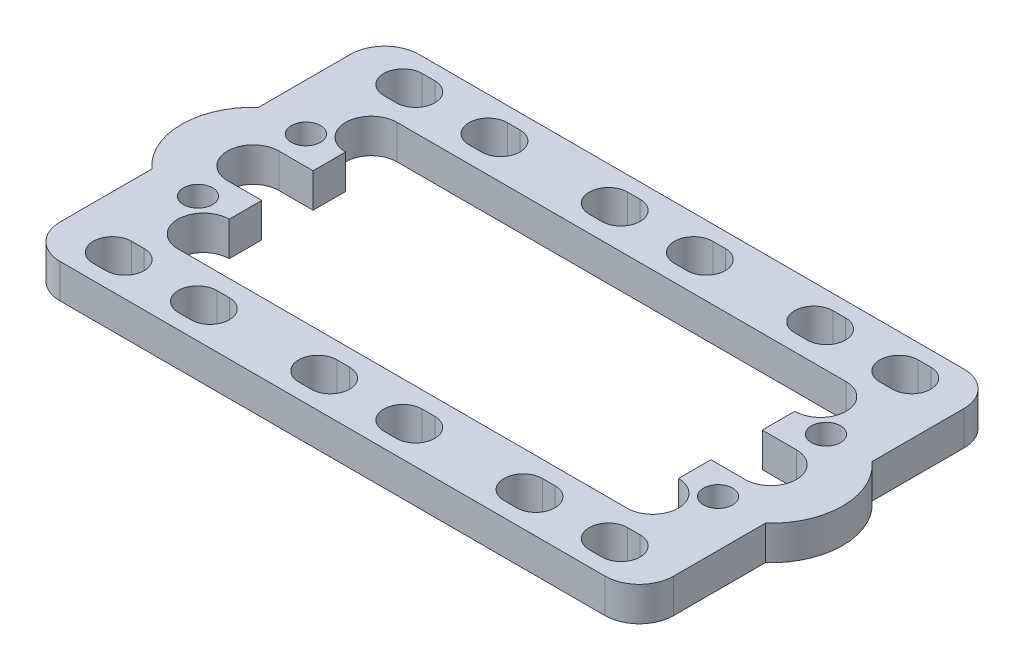
from build123d import *

# Parameters (mm, degrees)
BOSS_EXTRUDE1_DEPTH   = 3.175
F_6_32_TAPPED_HOLE1_D = 2.7051
CUT_EXTRUDE1_REACH    = 69.902


with BuildPart() as part:
    # Sketch1 → Boss-Extrude1 (new body)
    with BuildSketch(Plane(origin=(0, 0, 0), x_dir=(1, 0, 0), z_dir=(0, 1, 0))):
        with BuildLine():
            Line((3.175, 0), (53.721, 0))
            ThreePointArc((53.721, 0), (55.96606403, 0.92993597), (56.896, 3.175))
            Line((56.896, 3.175), (56.896, 11.684))
            ThreePointArc((56.896, 11.684), (59.1058, 16.637), (56.896, 21.59))
            Line((56.896, 21.59), (56.896, 30.099))
            ThreePointArc((56.896, 30.099), (55.96606403, 32.34406403), (53.721, 33.274))
            Line((53.721, 33.274), (3.175, 33.274))
            ThreePointArc((3.175, 33.274), (0.92993597, 32.34406403), (0, 30.099))
            Line((0, 30.099), (0, 21.59))
            ThreePointArc((0, 21.59), (-2.2098, 16.637), (0, 11.684))
            Line((0, 11.684), (0, 3.175))
            ThreePointArc((0, 3.175), (0.92993597, 0.92993597), (3.175, 0))
        make_face()
        with BuildLine():
            Line((49.276, 26.797), (7.62, 26.797))
            ThreePointArc((7.62, 26.797), (5.23875, 24.41575), (7.62, 22.0345))
            Line((7.62, 22.0345), (7.62, 19.01825))
            Line((7.62, 19.01825), (4.445875862, 19.01825))
            ThreePointArc((4.445875862, 19.01825), (2.064625862, 16.637), (4.445875862, 14.25575))
            Line((4.445875862, 14.25575), (7.62, 14.25575))
            Line((7.62, 14.25575), (7.62, 11.2395))
            ThreePointArc((7.62, 11.2395), (5.23875, 8.85825), (7.62, 6.477))
            Line((7.62, 6.477), (49.276, 6.477))
            ThreePointArc((49.276, 6.477), (51.65725, 8.85825), (49.276, 11.2395))
            Line((49.276, 11.2395), (49.276, 14.25575))
            Line((49.276, 14.25575), (52.450124138, 14.25575))
            ThreePointArc((52.450124138, 14.25575), (54.831374138, 16.637), (52.450124138, 19.01825))
            Line((52.450124138, 19.01825), (49.276, 19.01825))
            Line((49.276, 19.01825), (49.276, 22.0345))
            ThreePointArc((49.276, 22.0345), (51.65725, 24.41575), (49.276, 26.797))
        make_face(mode=Mode.SUBTRACT)
    extrude(amount=BOSS_EXTRUDE1_DEPTH)

    # #6-32 Tapped Hole1 (through all)
    with Locations(Plane(origin=(0, 3.175, 0), x_dir=(1, 0, 0), z_dir=(0, 1, 0))):
        with Locations((4.3307, 21.6408), (4.3307, 11.6332), (52.5653, 11.6332), (52.5653, 21.6408)):
            Hole(F_6_32_TAPPED_HOLE1_D / 2)

    # Sketch5 → Cut-Extrude1 (cut, up to next)
    with BuildSketch(Plane(origin=(0, 3.175, 0), x_dir=(1, 0, 0), z_dir=(0, 1, 0)), mode=Mode.PRIVATE) as cut_extrude1_sk1:
        with BuildLine():
            Line((23.9141, 31.8897), (25.0825, 31.8897))
            ThreePointArc((25.0825, 31.8897), (26.8605, 30.1117), (25.0825, 28.3337))
            Line((25.0825, 28.3337), (23.9141, 28.3337))
            ThreePointArc((23.9141, 28.3337), (22.1361, 30.1117), (23.9141, 31.8897))
        make_face()
    cut_extrude1_tool1 = extrude(cut_extrude1_sk1.sketch, amount=-CUT_EXTRUDE1_REACH, mode=Mode.PRIVATE) & part.part
    # Sketch5 → Cut-Extrude1 (cut, up to next)
    with BuildSketch(Plane(origin=(0, 3.175, 0), x_dir=(1, 0, 0), z_dir=(0, 1, 0)), mode=Mode.PRIVATE) as cut_extrude1_sk2:
        with BuildLine():
            Line((12.7635, 31.8897), (13.9319, 31.8897))
            ThreePointArc((13.9319, 31.8897), (15.7099, 30.1117), (13.9319, 28.3337))
            Line((13.9319, 28.3337), (12.7635, 28.3337))
            ThreePointArc((12.7635, 28.3337), (10.9855, 30.1117), (12.7635, 31.8897))
        make_face()
    cut_extrude1_tool2 = extrude(cut_extrude1_sk2.sketch, amount=-CUT_EXTRUDE1_REACH, mode=Mode.PRIVATE) & part.part
    # Sketch5 → Cut-Extrude1 (cut, up to next)
    with BuildSketch(Plane(origin=(0, 3.175, 0), x_dir=(1, 0, 0), z_dir=(0, 1, 0)), mode=Mode.PRIVATE) as cut_extrude1_sk3:
        with BuildLine():
            Line((4.8641, 31.8897), (6.0325, 31.8897))
            ThreePointArc((6.0325, 31.8897), (7.8105, 30.1117), (6.0325, 28.3337))
            Line((6.0325, 28.3337), (4.8641, 28.3337))
            ThreePointArc((4.8641, 28.3337), (3.0861, 30.1117), (4.8641, 31.8897))
        make_face()
    cut_extrude1_tool3 = extrude(cut_extrude1_sk3.sketch, amount=-CUT_EXTRUDE1_REACH, mode=Mode.PRIVATE) & part.part
    # Sketch5 → Cut-Extrude1 (cut, up to next)
    with BuildSketch(Plane(origin=(0, 3.175, 0), x_dir=(1, 0, 0), z_dir=(0, 1, 0)), mode=Mode.PRIVATE) as cut_extrude1_sk4:
        with BuildLine():
            Line((32.9819, 31.8897), (31.8135, 31.8897))
            ThreePointArc((31.8135, 31.8897), (30.0355, 30.1117), (31.8135, 28.3337))
            Line((31.8135, 28.3337), (32.9819, 28.3337))
            ThreePointArc((32.9819, 28.3337), (34.7599, 30.1117), (32.9819, 31.8897))
        make_face()
    cut_extrude1_tool4 = extrude(cut_extrude1_sk4.sketch, amount=-CUT_EXTRUDE1_REACH, mode=Mode.PRIVATE) & part.part
    # Sketch5 → Cut-Extrude1 (cut, up to next)
    with BuildSketch(Plane(origin=(0, 3.175, 0), x_dir=(1, 0, 0), z_dir=(0, 1, 0)), mode=Mode.PRIVATE) as cut_extrude1_sk5:
        with BuildLine():
            Line((44.1325, 31.8897), (42.9641, 31.8897))
            ThreePointArc((42.9641, 31.8897), (41.1861, 30.1117), (42.9641, 28.3337))
            Line((42.9641, 28.3337), (44.1325, 28.3337))
            ThreePointArc((44.1325, 28.3337), (45.9105, 30.1117), (44.1325, 31.8897))
        make_face()
    cut_extrude1_tool5 = extrude(cut_extrude1_sk5.sketch, amount=-CUT_EXTRUDE1_REACH, mode=Mode.PRIVATE) & part.part
    # Sketch5 → Cut-Extrude1 (cut, up to next)
    with BuildSketch(Plane(origin=(0, 3.175, 0), x_dir=(1, 0, 0), z_dir=(0, 1, 0)), mode=Mode.PRIVATE) as cut_extrude1_sk6:
        with BuildLine():
            Line((52.0319, 31.8897), (50.8635, 31.8897))
            ThreePointArc((50.8635, 31.8897), (49.0855, 30.1117), (50.8635, 28.3337))
            Line((50.8635, 28.3337), (52.0319, 28.3337))
            ThreePointArc((52.0319, 28.3337), (53.8099, 30.1117), (52.0319, 31.8897))
        make_face()
    cut_extrude1_tool6 = extrude(cut_extrude1_sk6.sketch, amount=-CUT_EXTRUDE1_REACH, mode=Mode.PRIVATE) & part.part
    # Sketch5 → Cut-Extrude1 (cut, up to next)
    with BuildSketch(Plane(origin=(0, 3.175, 0), x_dir=(1, 0, 0), z_dir=(0, 1, 0)), mode=Mode.PRIVATE) as cut_extrude1_sk7:
        with BuildLine():
            Line((52.0319, 1.3843), (50.8635, 1.3843))
            ThreePointArc((50.8635, 1.3843), (49.0855, 3.1623), (50.8635, 4.9403))
            Line((50.8635, 4.9403), (52.0319, 4.9403))
            ThreePointArc((52.0319, 4.9403), (53.8099, 3.1623), (52.0319, 1.3843))
        make_face()
    cut_extrude1_tool7 = extrude(cut_extrude1_sk7.sketch, amount=-CUT_EXTRUDE1_REACH, mode=Mode.PRIVATE) & part.part
    # Sketch5 → Cut-Extrude1 (cut, up to next)
    with BuildSketch(Plane(origin=(0, 3.175, 0), x_dir=(1, 0, 0), z_dir=(0, 1, 0)), mode=Mode.PRIVATE) as cut_extrude1_sk8:
        with BuildLine():
            Line((44.1325, 1.3843), (42.9641, 1.3843))
            ThreePointArc((42.9641, 1.3843), (41.1861, 3.1623), (42.9641, 4.9403))
            Line((42.9641, 4.9403), (44.1325, 4.9403))
            ThreePointArc((44.1325, 4.9403), (45.9105, 3.1623), (44.1325, 1.3843))
        make_face()
    cut_extrude1_tool8 = extrude(cut_extrude1_sk8.sketch, amount=-CUT_EXTRUDE1_REACH, mode=Mode.PRIVATE) & part.part
    # Sketch5 → Cut-Extrude1 (cut, up to next)
    with BuildSketch(Plane(origin=(0, 3.175, 0), x_dir=(1, 0, 0), z_dir=(0, 1, 0)), mode=Mode.PRIVATE) as cut_extrude1_sk9:
        with BuildLine():
            Line((32.9819, 1.3843), (31.8135, 1.3843))
            ThreePointArc((31.8135, 1.3843), (30.0355, 3.1623), (31.8135, 4.9403))
            Line((31.8135, 4.9403), (32.9819, 4.9403))
            ThreePointArc((32.9819, 4.9403), (34.7599, 3.1623), (32.9819, 1.3843))
        make_face()
    cut_extrude1_tool9 = extrude(cut_extrude1_sk9.sketch, amount=-CUT_EXTRUDE1_REACH, mode=Mode.PRIVATE) & part.part
    # Sketch5 → Cut-Extrude1 (cut, up to next)
    with BuildSketch(Plane(origin=(0, 3.175, 0), x_dir=(1, 0, 0), z_dir=(0, 1, 0)), mode=Mode.PRIVATE) as cut_extrude1_sk10:
        with BuildLine():
            Line((23.9141, 1.3843), (25.0825, 1.3843))
            ThreePointArc((25.0825, 1.3843), (26.8605, 3.1623), (25.0825, 4.9403))
            Line((25.0825, 4.9403), (23.9141, 4.9403))
            ThreePointArc((23.9141, 4.9403), (22.1361, 3.1623), (23.9141, 1.3843))
        make_face()
    cut_extrude1_tool10 = extrude(cut_extrude1_sk10.sketch, amount=-CUT_EXTRUDE1_REACH, mode=Mode.PRIVATE) & part.part
    # Sketch5 → Cut-Extrude1 (cut, up to next)
    with BuildSketch(Plane(origin=(0, 3.175, 0), x_dir=(1, 0, 0), z_dir=(0, 1, 0)), mode=Mode.PRIVATE) as cut_extrude1_sk11:
        with BuildLine():
            Line((12.7635, 1.3843), (13.9319, 1.3843))
            ThreePointArc((13.9319, 1.3843), (15.7099, 3.1623), (13.9319, 4.9403))
            Line((13.9319, 4.9403), (12.7635, 4.9403))
            ThreePointArc((12.7635, 4.9403), (10.9855, 3.1623), (12.7635, 1.3843))
        make_face()
    cut_extrude1_tool11 = extrude(cut_extrude1_sk11.sketch, amount=-CUT_EXTRUDE1_REACH, mode=Mode.PRIVATE) & part.part
    # Sketch5 → Cut-Extrude1 (cut, up to next)
    with BuildSketch(Plane(origin=(0, 3.175, 0), x_dir=(1, 0, 0), z_dir=(0, 1, 0)), mode=Mode.PRIVATE) as cut_extrude1_sk12:
        with BuildLine():
            Line((4.8641, 1.3843), (6.0325, 1.3843))
            ThreePointArc((6.0325, 1.3843), (7.8105, 3.1623), (6.0325, 4.9403))
            Line((6.0325, 4.9403), (4.8641, 4.9403))
            ThreePointArc((4.8641, 4.9403), (3.0861, 3.1623), (4.8641, 1.3843))
        make_face()
    cut_extrude1_tool12 = extrude(cut_extrude1_sk12.sketch, amount=-CUT_EXTRUDE1_REACH, mode=Mode.PRIVATE) & part.part
    add(cut_extrude1_tool1.solids().sort_by_distance((24.4983, 3.175, -30.1117))[0], mode=Mode.SUBTRACT)
    add(cut_extrude1_tool2.solids().sort_by_distance((13.3477, 3.175, -30.1117))[0], mode=Mode.SUBTRACT)
    add(cut_extrude1_tool3.solids().sort_by_distance((5.4483, 3.175, -30.1117))[0], mode=Mode.SUBTRACT)
    add(cut_extrude1_tool4.solids().sort_by_distance((32.3977, 3.175, -30.1117))[0], mode=Mode.SUBTRACT)
    add(cut_extrude1_tool5.solids().sort_by_distance((43.5483, 3.175, -30.1117))[0], mode=Mode.SUBTRACT)
    add(cut_extrude1_tool6.solids().sort_by_distance((51.4477, 3.175, -30.1117))[0], mode=Mode.SUBTRACT)
    add(cut_extrude1_tool7.solids().sort_by_distance((51.4477, 3.175, -3.1623))[0], mode=Mode.SUBTRACT)
    add(cut_extrude1_tool8.solids().sort_by_distance((43.5483, 3.175, -3.1623))[0], mode=Mode.SUBTRACT)
    add(cut_extrude1_tool9.solids().sort_by_distance((32.3977, 3.175, -3.1623))[0], mode=Mode.SUBTRACT)
    add(cut_extrude1_tool10.solids().sort_by_distance((24.4983, 3.175, -3.1623))[0], mode=Mode.SUBTRACT)
    add(cut_extrude1_tool11.solids().sort_by_distance((13.3477, 3.175, -3.1623))[0], mode=Mode.SUBTRACT)
    add(cut_extrude1_tool12.solids().sort_by_distance((5.4483, 3.175, -3.1623))[0], mode=Mode.SUBTRACT)


solid = part.part
